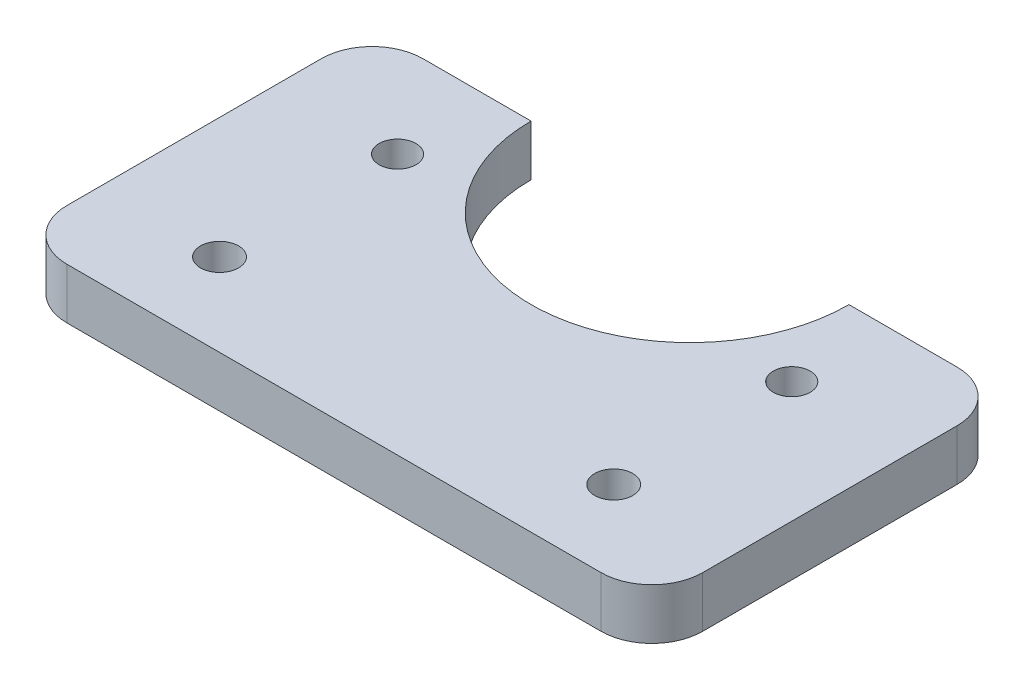
from build123d import *

# Parameters (mm, degrees)
SKETCH_1_W          = 50
SKETCH_1_H          = 25
EXTRUDE_1_DEPTH     = 4
SKETCH_2_R          = 1.45
CUT_EXTRUDE_1_DEPTH = 4
SKETCH_3_R          = 12.5
CUT_EXTRUDE_2_DEPTH = 4
SKETCH_5_W          = 50
SKETCH_5_H          = 4
EXTRUDE_2_DEPTH     = 3
FILLET_1_R          = 4
SKETCH_11_R         = 1.5
CUT_EXTRUDE_4_DEPTH = 10


with BuildPart() as part:
    # 草图1 → 凸台-拉伸1 (new body)
    with BuildSketch(Plane(origin=(0, 0, 0), x_dir=(1, 0, 0), z_dir=(0, 1, 0))):
        Rectangle(SKETCH_1_W, SKETCH_1_H)
    extrude(amount=EXTRUDE_1_DEPTH)

    # 草图2 → 切除-拉伸1 (cut)
    with BuildSketch(Plane(origin=(0, 4, 0), x_dir=(1, 0, 0), z_dir=(0, 1, 0))):
        with Locations(Location((-15.5, 5, 0), (0, 0, 270))):
            Circle(SKETCH_2_R)
        with Locations(Location((15.5, 5, 0), (0, 0, 270))):
            Circle(SKETCH_2_R)
    extrude(amount=-CUT_EXTRUDE_1_DEPTH, mode=Mode.SUBTRACT)

    # 草图3 → 切除-拉伸2 (cut)
    with BuildSketch(Plane(origin=(0, 4, 0), x_dir=(1, 0, 0), z_dir=(0, 1, 0))):
        with Locations((0, 12.5)):
            Circle(SKETCH_3_R)
    extrude(amount=-CUT_EXTRUDE_2_DEPTH, mode=Mode.SUBTRACT)

    # 草图5 → 凸台-拉伸2 (add)
    with BuildSketch(Plane.XY.offset(12.5)):
        with Locations((0, 2)):
            Rectangle(SKETCH_5_W, SKETCH_5_H)
    extrude(amount=EXTRUDE_2_DEPTH)

    # 圆角1
    fillet_1_edges = [part.edges().sort_by_distance(p)[0] for p in [
        (-25, 2, 15.5),
        (25, 2, 15.5),
        (-25, 2, -12.5),
        (25, 2, -12.5),
    ]]
    fillet(fillet_1_edges, radius=FILLET_1_R)

    # 草图11 → 切除-拉伸4 (cut)
    with BuildSketch(Plane(origin=(0, 4, 0), x_dir=(1, 0, 0), z_dir=(0, 1, 0))):
        with Locations(Location((-15.5, -9, 0), (0, 0, 270))):
            Circle(SKETCH_11_R)
        with Locations(Location((15.5, -9, 0), (0, 0, 270))):
            Circle(SKETCH_11_R)
    extrude(amount=-CUT_EXTRUDE_4_DEPTH, mode=Mode.SUBTRACT)


solid = part.part
